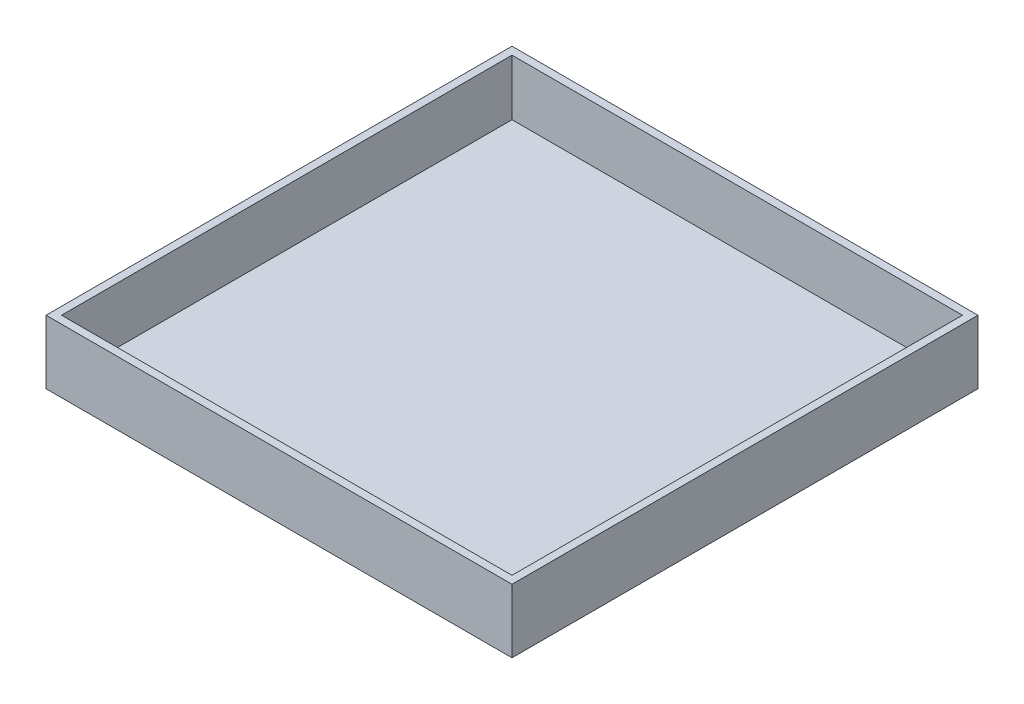
from build123d import *

# Parameters (mm, degrees)
SKETCH1_W           = 300
SKETCH1_H           = 300
BOSS_EXTRUDE1_DEPTH = 5
SKETCH2_W           = 300
SKETCH2_H           = 300
SKETCH2_W_2         = 290
SKETCH2_H_2         = 290
BOSS_EXTRUDE2_DEPTH = 36


with BuildPart() as part:
    # Sketch1 → Boss-Extrude1 (new body)
    with BuildSketch(Plane(origin=(0, 0, 0), x_dir=(1, 0, 0), z_dir=(0, 1, 0))):
        Rectangle(SKETCH1_W, SKETCH1_H)
    extrude(amount=BOSS_EXTRUDE1_DEPTH)

    # Sketch2 → Boss-Extrude2 (add)
    with BuildSketch(Plane(origin=(0, 5, 0), x_dir=(1, 0, 0), z_dir=(0, 1, 0))):
        Rectangle(SKETCH2_W, SKETCH2_H)
        Rectangle(SKETCH2_W_2, SKETCH2_H_2, mode=Mode.SUBTRACT)
    extrude(amount=BOSS_EXTRUDE2_DEPTH)


solid = part.part
